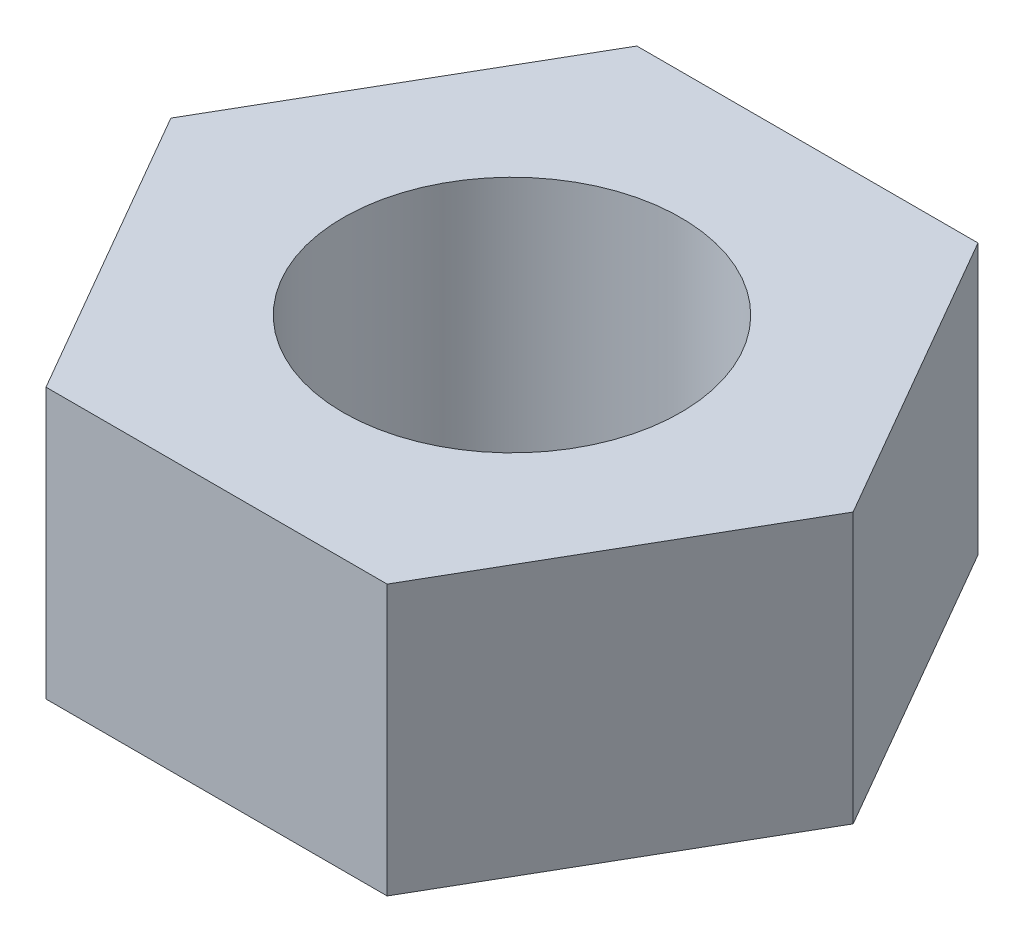
from build123d import *

# Parameters (mm, degrees)
SKETCH1_R           = 2
BOSS_EXTRUDE1_DEPTH = 3.2


with BuildPart() as part:
    # Sketch1 → Boss-Extrude1 (new body)
    with BuildSketch(Plane(origin=(0, 0, 0), x_dir=(1, 0, 0), z_dir=(0, 1, 0))):
        Polygon((2.020725942, -3.5), (4.041451884, 0), (2.020725942, 3.5), (-2.020725942, 3.5), (-4.041451884, 0), (-2.020725942, -3.5), align=None)
        with Locations(Location((0, 0, 0), (0, 0, 270))):
            Circle(SKETCH1_R, mode=Mode.SUBTRACT)
    extrude(amount=BOSS_EXTRUDE1_DEPTH)


solid = part.part
